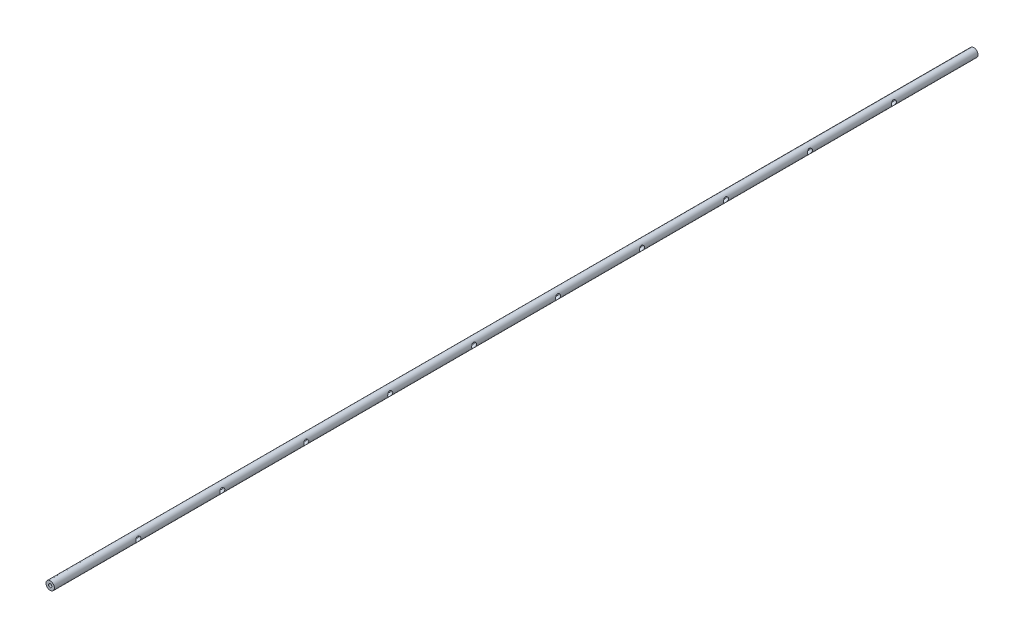
from build123d import *

# Parameters (mm, degrees)
SKETCH_1_R               = 5
EXTRUDE_1_DEPTH          = 1100
CUT_EXTRUDE_2_DEPTH      = 1101.022727038
CUT_EXTRUDE_2_DEPTH_BACK = 1101.022727038
SKETCH_2_R               = 3
CUT_EXTRUDE_3_DEPTH      = 1101.022727139
CUT_EXTRUDE_3_DEPTH_BACK = 1101.022727139
SKETCH_3_R               = 2


with BuildPart() as part:
    # 草图1 → 凸台-拉伸1 (new body)
    with BuildSketch(Plane.XY):
        Circle(SKETCH_1_R)
    extrude(amount=EXTRUDE_1_DEPTH)

    # 草图2 → 切除-拉伸2 (cut, two sides: drawn at the far end of the back side and taken through both)
    with BuildSketch(Plane(origin=(0, 0, 0), x_dir=(0, 0, -1), z_dir=(1, 0, 0)).offset(-CUT_EXTRUDE_2_DEPTH_BACK)):
        with Locations(Location((-100, 0, 0), (0, 0, 179.999999986))):
            Circle(SKETCH_2_R)
        with Locations(Location((-200, 0, 0), (0, 0, 179.999999986))):
            Circle(SKETCH_2_R)
        with Locations(Location((-300, 0, 0), (0, 0, 179.999999986))):
            Circle(SKETCH_2_R)
        with Locations(Location((-400, 0, 0), (0, 0, 179.999999986))):
            Circle(SKETCH_2_R)
        with Locations(Location((-500, 0, 0), (0, 0, 179.999999986))):
            Circle(SKETCH_2_R)
        with Locations(Location((-600, 0, 0), (0, 0, 179.999999986))):
            Circle(SKETCH_2_R)
        with Locations(Location((-700, 0, 0), (0, 0, 179.999999986))):
            Circle(SKETCH_2_R)
        with Locations(Location((-800, 0, 0), (0, 0, 179.999999986))):
            Circle(SKETCH_2_R)
        with Locations(Location((-900, 0, 0), (0, 0, 179.999999986))):
            Circle(SKETCH_2_R)
        with Locations(Location((-1000, 0, 0), (0, 0, 179.999999986))):
            Circle(SKETCH_2_R)
    extrude(amount=CUT_EXTRUDE_2_DEPTH + CUT_EXTRUDE_2_DEPTH_BACK, mode=Mode.SUBTRACT)

    # 草图3 → 切除-拉伸3 (cut, two sides: drawn at the far end of the back side and taken through both)
    with BuildSketch(Plane.XY.offset(1100).offset(-CUT_EXTRUDE_3_DEPTH_BACK)):
        with Locations(Location((0, 0, 0), (0, 0, 179.999999981))):
            Circle(SKETCH_3_R)
    extrude(amount=CUT_EXTRUDE_3_DEPTH + CUT_EXTRUDE_3_DEPTH_BACK, mode=Mode.SUBTRACT)


solid = part.part
